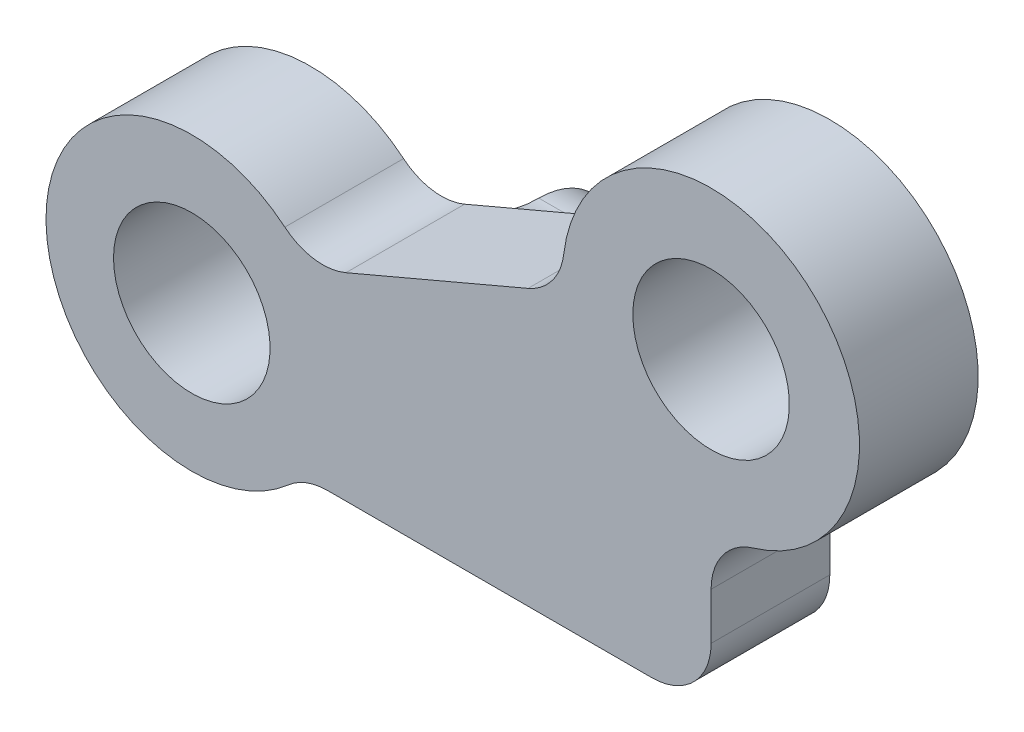
from build123d import *

# Parameters (mm, degrees)
BOSS_EXTRUDE3_DEPTH = 4
HOLE3_D             = 5.275
FILLET3_R           = 2
SKETCH25_R          = 1.506522666
BOSS_EXTRUDE4_DEPTH = 2


with BuildPart() as part:
    # Sketch17 → Boss-Extrude3 (new body)
    with BuildSketch(Plane(origin=(0, 0, 0), x_dir=(-1, 0, 0), z_dir=(0, 0, -1))):
        with BuildLine():
            Line((-43.273147001, 29.420937259), (-51.8645252, 33.076041142))
            ThreePointArc((-51.8645252, 33.076041142), (-60.191727201, 37.289326312), (-56.839071038, 28.579919803))
            Line((-56.839071038, 28.579919803), (-56.839071038, 23.292312115))
            Line((-56.839071038, 23.292312115), (-43.08257304, 23.292312115))
            ThreePointArc((-43.08257304, 23.292312115), (-34.429928081, 26.628647856), (-43.273147001, 29.420937259))
        make_face()
    extrude(amount=-BOSS_EXTRUDE3_DEPTH)

    # Hole3 (through all)
    with Locations(Plane(origin=(0, 0, 0), x_dir=(-1, 0, 0), z_dir=(0, 0, -1))):
        with Locations((-39.340592987, 26.475947236), (-56.839071038, 33.579919803)):
            Hole(HOLE3_D / 2)

    # Fillet3
    fillet3_edges = [part.edges().sort_by_distance(p)[0] for p in [
        (43.08257304, 23.292312115, 2),
        (56.839071038, 23.292312115, 2),
        (56.839071038, 28.579919803, 2),
        (51.8645252, 33.076041142, 2),
        (43.273147001, 29.420937259, 2),
    ]]
    fillet(fillet3_edges, radius=FILLET3_R)

    # Sketch25 → Boss-Extrude4 (add)
    with BuildSketch(Plane(origin=(47, 0, 0), x_dir=(0, 0, -1), z_dir=(1, 0, 0))):
        with BuildLine():
            Line((0, 23.292312115), (0, 30.144105031))
            add(Edge.make_bspline(
                [(2.034016737, 29.349553115), (0.844292257, 29.348828202), (0, 30.144105031)],
                knots=[0, 0, 0, 1, 1, 1], degree=2))
            ThreePointArc((2.034016737, 29.349553115), (4.534016737, 26.849553115), (2.034016737, 24.349553115))
            add(Edge.make_bspline(
                [(2.034016737, 24.349553115), (0.725821756, 24.359363318), (0, 23.292312115)],
                knots=[0, 0, 0, 1, 1, 1], degree=2))
        make_face()
        with Locations((2.034016737, 26.849553115)):
            Circle(SKETCH25_R, mode=Mode.SUBTRACT)
    extrude(amount=-BOSS_EXTRUDE4_DEPTH)


solid = part.part
